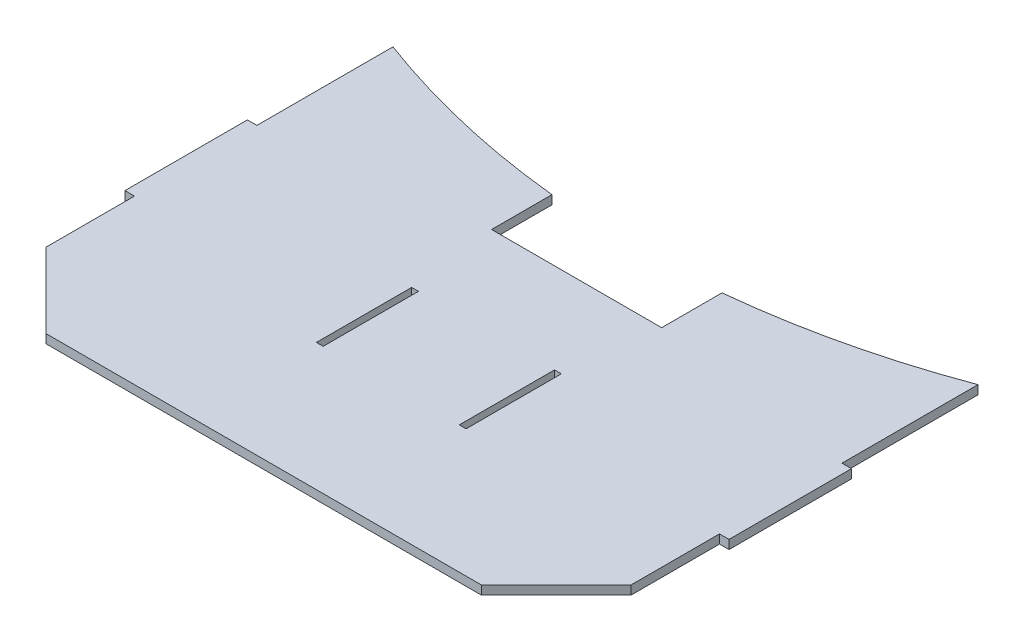
from build123d import *

# Parameters (mm, degrees)
BOSS_EXTRUDE1_DEPTH = 1.3
SKETCH2_W           = 1.4
SKETCH2_H           = 18
BOSS_EXTRUDE2_DEPTH = 1.3
SKETCH2_3_W         = 25
SKETCH2_3_H         = 16
CUT_EXTRUDE1_DEPTH  = 55.166871794
CUT_EXTRUDE2_DEPTH  = 55.166871794
SKETCH7_W           = 1
SKETCH7_H           = 14
CUT_EXTRUDE3_DEPTH  = 55.166871794


with BuildPart() as part:
    # Sketch1 → Boss-Extrude1 (new body)
    with BuildSketch(Plane(origin=(0, 0, 0), x_dir=(1, 0, 0), z_dir=(0, 1, 0))):
        Polygon((-43, 31), (43, 31), (43, -20), (32, -31), (-32, -31), (-43, -20), align=None)
    extrude(amount=BOSS_EXTRUDE1_DEPTH)

    # Sketch2 → Boss-Extrude2 (add)
    with BuildSketch(Plane(origin=(0, 0, 0), x_dir=(1, 0, 0), z_dir=(0, 1, 0))):
        with Locations((43.7, 2)):
            Rectangle(SKETCH2_W, SKETCH2_H)
        with Locations((-43.7, 2)):
            Rectangle(SKETCH2_W, SKETCH2_H)
    extrude(amount=BOSS_EXTRUDE2_DEPTH)

    # Sketch2<3> → Cut-Extrude1 (cut, through all)
    with BuildSketch(Plane(origin=(0, 0, 0), x_dir=(1, 0, 0), z_dir=(0, 1, 0))):
        with Locations((0, 23)):
            Rectangle(SKETCH2_3_W, SKETCH2_3_H)
    extrude(amount=CUT_EXTRUDE1_DEPTH, mode=Mode.SUBTRACT)

    # Sketch6 → Cut-Extrude2 (cut, through all)
    with BuildSketch(Plane(origin=(0, 1.3, 0), x_dir=(1, 0, 0), z_dir=(0, 1, 0))):
        with BuildLine():
            Line((-43, 31), (43, 31))
            ThreePointArc((43, 31), (0, 23.231359566), (-43, 31))
        make_face()
    extrude(amount=-CUT_EXTRUDE2_DEPTH, mode=Mode.SUBTRACT)

    # Sketch7 → Cut-Extrude3 (cut, through all)
    with BuildSketch(Plane(origin=(0, 1.3, 0), x_dir=(1, 0, 0), z_dir=(0, 1, 0))):
        with Locations((-10.5, -5.25)):
            Rectangle(SKETCH7_W, SKETCH7_H)
        with Locations((10.5, -5.25)):
            Rectangle(SKETCH7_W, SKETCH7_H)
    extrude(amount=-CUT_EXTRUDE3_DEPTH, mode=Mode.SUBTRACT)


solid = part.part
